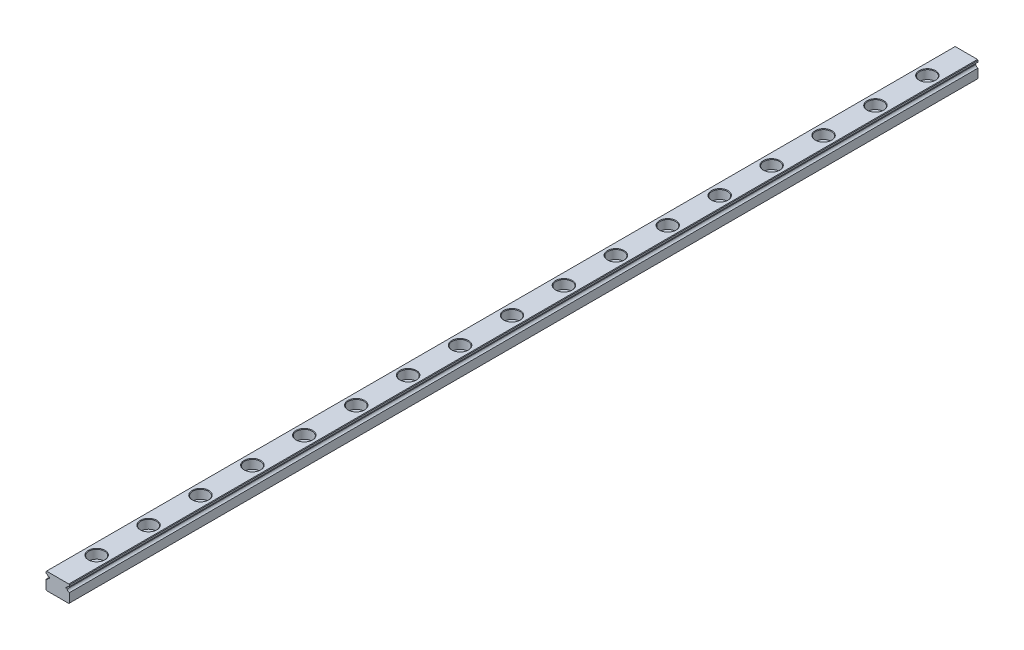
from build123d import *

# Parameters (mm, degrees)
EXTRUDE1_DEPTH             = 350
EXTRUDE2_REACH             = 352.089
SKETCH2_R                  = 1.75
SKETCH_R                   = 3
SKETCH_R_2                 = 1.75
EXTRUDE4_DEPTH             = 3.5
CHAMFER1_SIZE              = 0.2
LPATTERN1_COUNT            = 17
LPATTERN1_PITCH            = 20
CHAMFER1_OF_LPATTERN1_SIZE = 0.2


with BuildPart() as part:
    # Sketch1 → Extrude1 (new body)
    with BuildSketch(Plane.XY):
        with BuildLine():
            Line((-4.3, -3.25), (4.3, -3.25))
            Line((4.3, -3.25), (4.5, -3.05))
            Line((4.5, -3.05), (4.5, 0.455012563))
            ThreePointArc((4.5, 0.455012563), (3.924845827, 0.712323349), (3.617735397, 1.2625))
            Line((3.617735397, 1.2625), (3.15008224, 1.2625))
            Line((3.15008224, 1.2625), (3.15008224, 1.7625))
            Line((3.15008224, 1.7625), (3.65008224, 1.7625))
            ThreePointArc((3.65008224, 1.7625), (3.973877727, 2.229724887), (4.5, 2.444987437))
            Line((4.5, 2.444987437), (4.5, 3.05))
            Line((4.5, 3.05), (4.3, 3.25))
            Line((4.3, 3.25), (-4.3, 3.25))
            Line((-4.3, 3.25), (-4.5, 3.05))
            Line((-4.5, 3.05), (-4.5, 2.444987437))
            ThreePointArc((-4.5, 2.444987437), (-3.973877727, 2.229724887), (-3.65008224, 1.7625))
            Line((-3.65008224, 1.7625), (-3.15008224, 1.7625))
            Line((-3.15008224, 1.7625), (-3.15008224, 1.2625))
            Line((-3.15008224, 1.2625), (-3.617735397, 1.2625))
            ThreePointArc((-3.617735397, 1.2625), (-3.924845827, 0.712323349), (-4.5, 0.455012563))
            Line((-4.5, 0.455012563), (-4.5, -3.05))
            Line((-4.5, -3.05), (-4.3, -3.25))
        make_face()
    extrude(amount=EXTRUDE1_DEPTH)

    # Sketch2 → Extrude2 (cut, up to next)
    with BuildSketch(Plane(origin=(0, 3.25, 0), x_dir=(1, 0, 0), z_dir=(0, 1, 0)), mode=Mode.PRIVATE) as extrude2_sk1:
        with Locations((0, -15)):
            Circle(SKETCH2_R)
    extrude2_tool1 = extrude(extrude2_sk1.sketch, amount=-EXTRUDE2_REACH, mode=Mode.PRIVATE) & part.part
    extrude2 = extrude2_tool1.solids().sort_by_distance((0, 3.25, 15))[0]
    add(extrude2, mode=Mode.SUBTRACT)

    # Sketch → Extrude4 (cut)
    with BuildSketch(Plane(origin=(0, 3.25, 0), x_dir=(1, 0, 0), z_dir=(0, 1, 0))):
        with Locations((0, -15)):
            Circle(SKETCH_R)
        with Locations((0, -15)):
            Circle(SKETCH_R_2, mode=Mode.SUBTRACT)
    extrude4 = extrude(amount=-EXTRUDE4_DEPTH, mode=Mode.SUBTRACT)

    # Chamfer1
    chamfer1_edges = [part.edges().sort_by_distance(p)[0] for p in [
        (-1.75, -3.25, 15),
        (-3, 3.25, 15),
    ]]
    chamfer(chamfer1_edges, length=CHAMFER1_SIZE)

    # LPattern1: Extrude2, Extrude4 ×17
    with Locations(*[(0, 0, i * LPATTERN1_PITCH) for i in range(1, LPATTERN1_COUNT)]):
        add(extrude2, mode=Mode.SUBTRACT)
        add(extrude4, mode=Mode.SUBTRACT)

    # Chamfer1 of LPattern1
    chamfer1_of_lpattern1_edges = [part.edges().sort_by_distance(p)[0] for p in [
        (-1.75, -3.25, 35),
        (-3, 3.25, 35),
        (-1.75, -3.25, 55),
        (-3, 3.25, 55),
        (-1.75, -3.25, 75),
        (-3, 3.25, 75),
        (-1.75, -3.25, 95),
        (-3, 3.25, 95),
        (-1.75, -3.25, 115),
        (-3, 3.25, 115),
        (-1.75, -3.25, 135),
        (-3, 3.25, 135),
        (-1.75, -3.25, 155),
        (-3, 3.25, 155),
        (-1.75, -3.25, 175),
        (-3, 3.25, 175),
        (-1.75, -3.25, 195),
        (-3, 3.25, 195),
        (-1.75, -3.25, 215),
        (-3, 3.25, 215),
        (-1.75, -3.25, 235),
        (-3, 3.25, 235),
        (-1.75, -3.25, 255),
        (-3, 3.25, 255),
        (-1.75, -3.25, 275),
        (-3, 3.25, 275),
        (-1.75, -3.25, 295),
        (-3, 3.25, 295),
        (-1.75, -3.25, 315),
        (-3, 3.25, 315),
        (-1.75, -3.25, 335),
        (-3, 3.25, 335),
    ]]
    chamfer(chamfer1_of_lpattern1_edges, length=CHAMFER1_OF_LPATTERN1_SIZE)


solid = part.part
